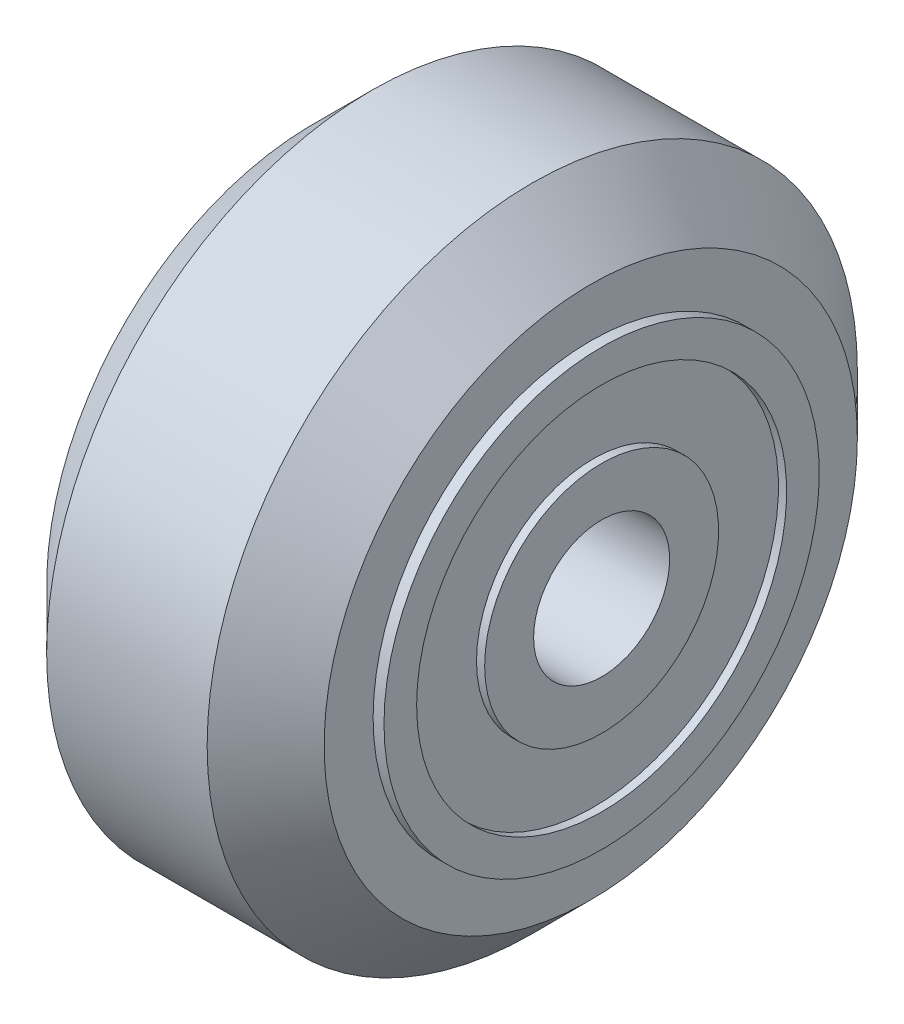
from build123d import *

# Parameters (mm, degrees)
BOSS_EXTRU_1_DEPTH      = 0.4
BOSS_EXTRU_1_DEPTH_BACK = 10.6
ESQUISSE1_R             = 8
ESQUISSE1_R_2           = 2.5
ESQUISSE2_R             = 6.8
ESQUISSE2_R_2           = 4.3
ENL_V_MAT_EXTRU_1_DEPTH = 0.3


with BuildPart() as part:
    # Sketch1 → Revolve1 (revolve)
    with BuildSketch(Plane.XY, mode=Mode.PRIVATE) as revolve1_sk:
        Polygon((0.5, 7), (-0.5, 7), (-0.5, 8), (-5.1, 8), (-5.1, 9.8), (-2.95, 11.95), (2.95, 11.95), (5.1, 9.8), (5.1, 8), (0.5, 8), align=None)
    revolve(revolve1_sk.sketch.rotate(Axis((0, 0, 0), (-1, 0, 0)), 90), axis=Axis((0, 0, 0), (-1, 0, 0)))

    # Esquisse1 → Boss.-Extru.1 (add, two sides: drawn at the far end of the back side and taken through both)
    with BuildSketch(Plane.ZY.offset(5.1).offset(-BOSS_EXTRU_1_DEPTH_BACK)):
        Circle(ESQUISSE1_R)
        Circle(ESQUISSE1_R_2, mode=Mode.SUBTRACT)
    extrude(amount=BOSS_EXTRU_1_DEPTH + BOSS_EXTRU_1_DEPTH_BACK)

    # Esquisse2 → Enlèv. mat.-Extru.1 (cut)
    with BuildSketch(Plane.ZY.offset(5.5)):
        Circle(ESQUISSE2_R)
        Circle(ESQUISSE2_R_2, mode=Mode.SUBTRACT)
    enl_v_mat_extru_1 = extrude(amount=-ENL_V_MAT_EXTRU_1_DEPTH, mode=Mode.SUBTRACT)

    # Symétrie1: Enlèv. mat.-Extru.1 across plane
    add(enl_v_mat_extru_1.mirror(Plane(origin=(0, 0, 0), x_dir=(0, 0, 1), z_dir=(1, 0, 0))), mode=Mode.SUBTRACT)


solid = part.part
